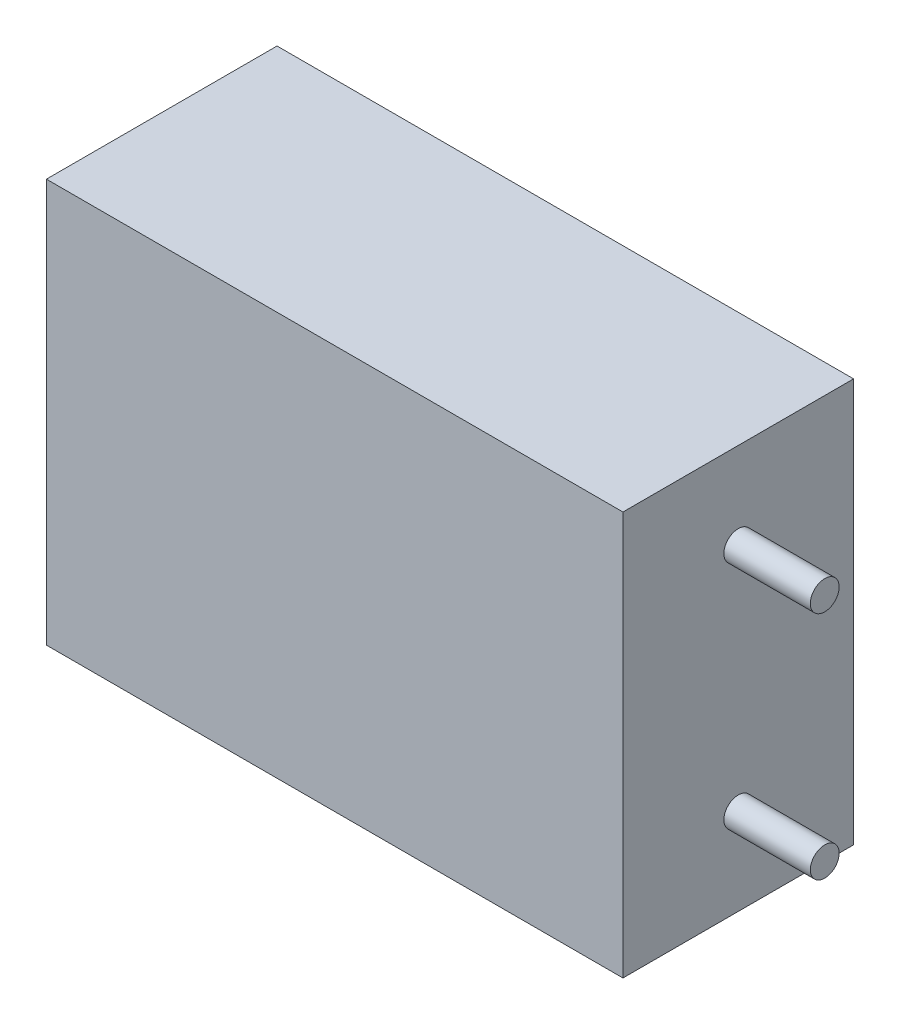
from build123d import *

# Parameters (mm, degrees)
SKETCH1_W           = 63.5
SKETCH1_H           = 25.4
BOSS_EXTRUDE1_DEPTH = 44.45
SKETCH2_R           = 1.5875
BOSS_EXTRUDE2_DEPTH = 9.525


with BuildPart() as part:
    # Sketch1 → Boss-Extrude1 (new body)
    with BuildSketch(Plane(origin=(0, 0, 0), x_dir=(1, 0, 0), z_dir=(0, 1, 0))):
        with Locations((6.853524229, 28.505066079)):
            Rectangle(SKETCH1_W, SKETCH1_H)
    extrude(amount=BOSS_EXTRUDE1_DEPTH)

    # Sketch2 → Boss-Extrude2 (add)
    with BuildSketch(Plane(origin=(38.603524229, 0, 0), x_dir=(0, 0, -1), z_dir=(1, 0, 0))):
        with Locations(Location((28.505066079, 34.925, 0), (0, 0, 180))):
            Circle(SKETCH2_R)
        with Locations(Location((28.505066079, 9.525, 0), (0, 0, 180))):
            Circle(SKETCH2_R)
    extrude(amount=BOSS_EXTRUDE2_DEPTH)


solid = part.part
